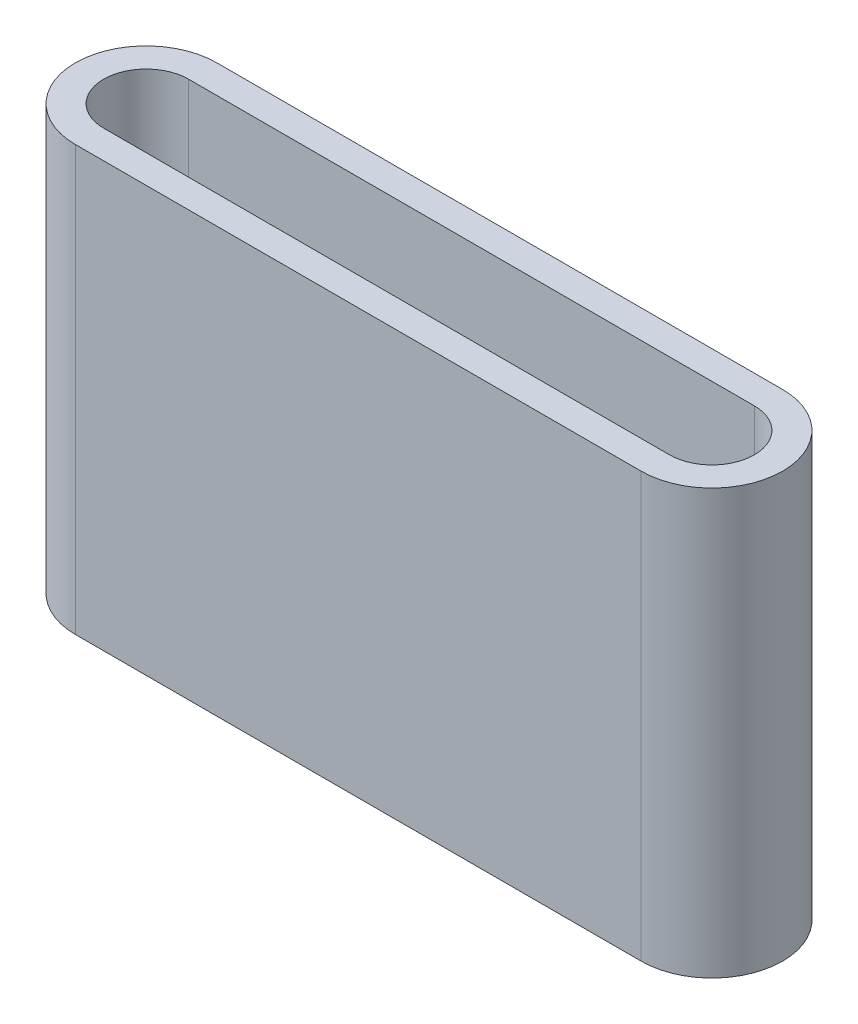
from build123d import *

# Parameters (mm, degrees)
EXTRUDE_1_DEPTH   = 20
EXTRUDE_1_2_DEPTH = 55


with BuildPart() as part:
    # 草图1 → Extrude 1 (new body)
    with BuildSketch(Plane(origin=(0, 0, 0), x_dir=(1, 0, 0), z_dir=(0, 1, 0))):
        with BuildLine():
            Line((-50.205761317, 12.5), (49.794238683, 12.5))
            ThreePointArc((49.794238683, 12.5), (62.294238683, 0), (49.794238683, -12.5))
            Line((49.794238683, -12.5), (-50.205761317, -12.5))
            ThreePointArc((-50.205761317, -12.5), (-62.705761317, 0), (-50.205761317, 12.5))
        make_face()
    extrude(amount=EXTRUDE_1_DEPTH)

    # 草图2 → Extrude 1 2 (add)
    with BuildSketch(Plane(origin=(0, 20, 0), x_dir=(1, 0, 0), z_dir=(0, 1, 0))):
        with BuildLine():
            Line((49.794238683, 12.5), (-50.205761317, 12.5))
            ThreePointArc((-50.205761317, 12.5), (-62.705761317, 0), (-50.205761317, -12.5))
            Line((-50.205761317, -12.5), (49.794238683, -12.5))
            ThreePointArc((49.794238683, -12.5), (62.294238683, 0), (49.794238683, 12.5))
        make_face()
        with BuildLine():
            Line((49.794238683, 7.5), (-50.205761317, 7.5))
            ThreePointArc((-50.205761317, 7.5), (-57.705761317, 0), (-50.205761317, -7.5))
            Line((-50.205761317, -7.5), (49.794238683, -7.5))
            ThreePointArc((49.794238683, -7.5), (57.294238683, 0), (49.794238683, 7.5))
        make_face(mode=Mode.SUBTRACT)
    extrude(amount=EXTRUDE_1_2_DEPTH)


solid = part.part
